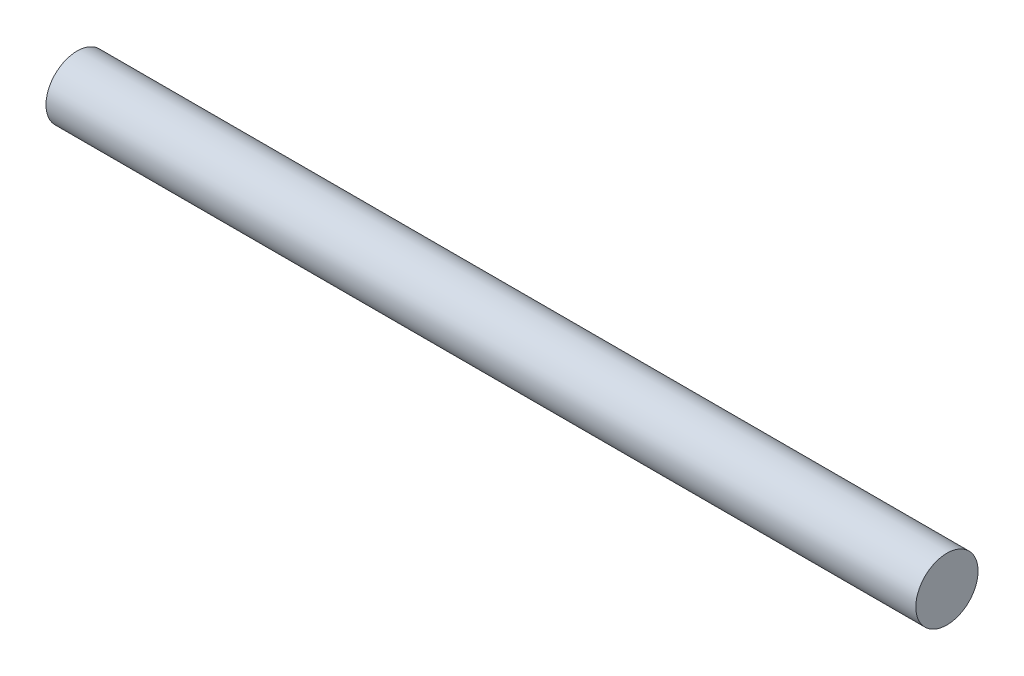
from build123d import *

# Parameters (mm, degrees)
IZIM2_R               = 0.5
KES_EKSTR_ZYON1_DEPTH = 10
IZIM4_W               = 23.900856007
IZIM4_H               = 1
IZIM4_W_2             = 0.459530198
KES_EKSTR_ZYON2_DEPTH = 10
KES_EKSTR_ZYON3_DEPTH = 0.3
IZIM6_R               = 0.5
KES_EKSTR_ZYON4_DEPTH = 7
IZIM7_R               = 0.5
KES_EKSTR_ZYON5_DEPTH = 5


with BuildPart() as part:
    # Süpür1: sweep along a path in Çizim1
    with BuildLine(Plane.XY) as s_p_r1_path:
        Line((0, 0), (50.361666029, 0))
    # Çizim2 → Süpür1 (sweep)
    with BuildSketch(Plane(origin=(50.361666029, 0, 0), x_dir=(0, 0, -1), z_dir=(1, 0, 0))):
        Circle(IZIM2_R)
    sweep(path=s_p_r1_path.line)

    # Çizim3 → Kes-Ekstrüzyon1 (cut)
    with BuildSketch(Plane.XY):
        Polygon((25.974112066, 2.781879013), (25.974112066, -2.743425523), (51.839823407, -2.743425523), (51.839823407, 3.328337703), align=None)
    extrude(amount=-KES_EKSTR_ZYON1_DEPTH, mode=Mode.SUBTRACT)

    # Çizim4 → Kes-Ekstrüzyon2 (cut)
    with BuildSketch(Plane(origin=(0, 0, 0), x_dir=(-1, 0, 0), z_dir=(0, 0, -1))):
        with Locations((-38.411238026, 0)):
            Rectangle(IZIM4_W, IZIM4_H)
        with Locations((-26.203877165, 0)):
            Rectangle(IZIM4_W_2, IZIM4_H)
    extrude(amount=-KES_EKSTR_ZYON2_DEPTH, mode=Mode.SUBTRACT)


with BuildPart() as kes_ekstr_zyon2_piece_1:
    # of the separate pieces the step leaves, piece 1, a body of its own (kes_ekstr_zyon2_pieces)
    add(part.part.solids().sort_by_distance((0, 0, -0.5))[0])

    # Çizim6 → Kes-Ekstrüzyon4 (cut)
    with BuildSketch(Plane(origin=(0, 0, 0), x_dir=(0, 0, -1), z_dir=(1, 0, 0))):
        Circle(IZIM6_R)
    extrude(amount=KES_EKSTR_ZYON4_DEPTH, mode=Mode.SUBTRACT)

    # Çizim7 → Kes-Ekstrüzyon5 (cut)
    with BuildSketch(Plane.ZY.offset(-7)):
        Circle(IZIM7_R)
    extrude(amount=-KES_EKSTR_ZYON5_DEPTH, mode=Mode.SUBTRACT)


with BuildPart() as kes_ekstr_zyon2_piece_2:
    # of the separate pieces the step leaves, piece 2, a body of its own (kes_ekstr_zyon2_pieces)
    add(part.part.solids().sort_by_distance((26.433642264, 0.5, 0))[0])

    # Çizim5 → Kes-Ekstrüzyon3 (cut)
    with BuildSketch(Plane(origin=(26.460810022, 0, 0), x_dir=(0, 0, -1), z_dir=(1, 0, 0))):
        with BuildLine():
            Line((0, 0.5), (0, -0.5))
            ThreePointArc((0, -0.5), (-0.5, 0), (0, 0.5))
        make_face()
    extrude(amount=-KES_EKSTR_ZYON3_DEPTH, mode=Mode.SUBTRACT)


solid = kes_ekstr_zyon2_piece_1.part
